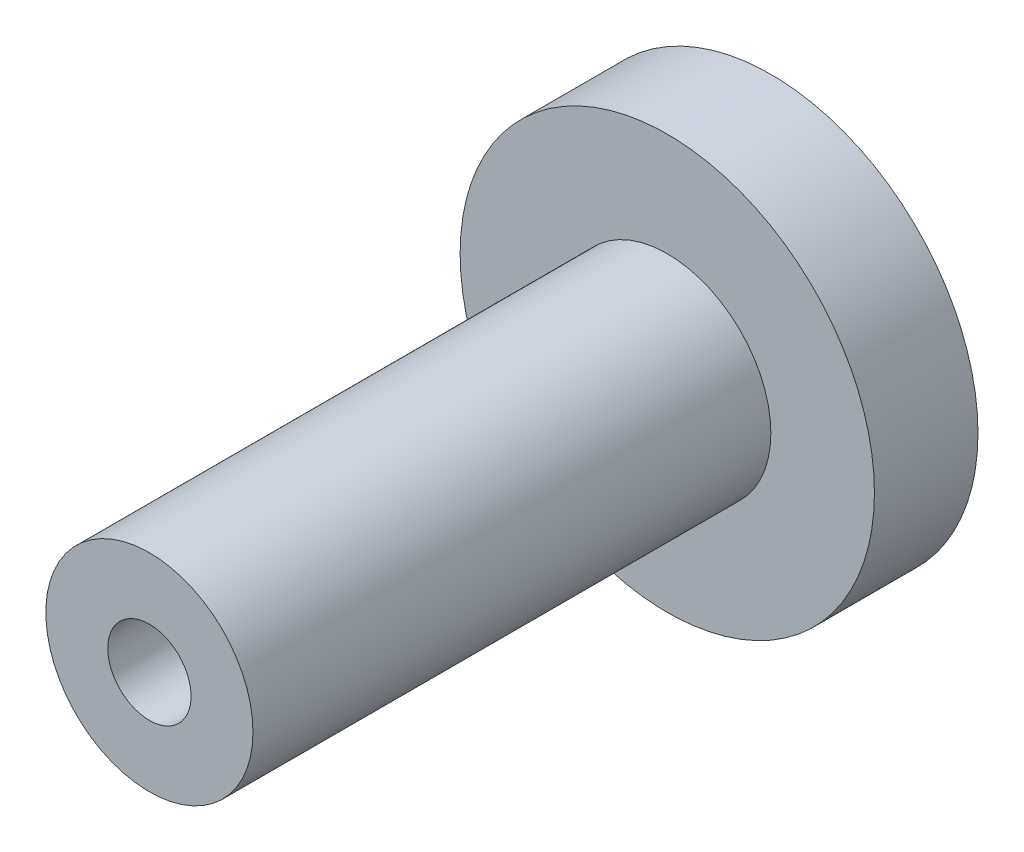
from build123d import *

# Parameters (mm, degrees)
SKETCH1_R           = 12.7
SKETCH1_R_2         = 2.555
BOSS_EXTRUDE1_DEPTH = 38.1
CUT_EXTRUDE1_START  = -31.75
SKETCH2_R           = 12.7
SKETCH2_R_2         = 6.35
CUT_EXTRUDE1_DEPTH  = 31.75


with BuildPart() as part:
    # Sketch1 → Boss-Extrude1 (new body)
    with BuildSketch(Plane.XY):
        with Locations(Location((0, 0, 0), (0, 0, 180))):
            Circle(SKETCH1_R)
        with Locations(Location((0, 0, 0), (0, 0, 180))):
            Circle(SKETCH1_R_2, mode=Mode.SUBTRACT)
    extrude(amount=BOSS_EXTRUDE1_DEPTH)

    # Sketch2 → Cut-Extrude1 (cut)
    with BuildSketch(Plane.XY.offset(38.1).offset(CUT_EXTRUDE1_START)):
        with Locations(Location((0, 0, 0), (0, 0, 180))):
            Circle(SKETCH2_R)
        Circle(SKETCH2_R_2, mode=Mode.SUBTRACT)
    extrude(amount=CUT_EXTRUDE1_DEPTH, mode=Mode.SUBTRACT)


solid = part.part
